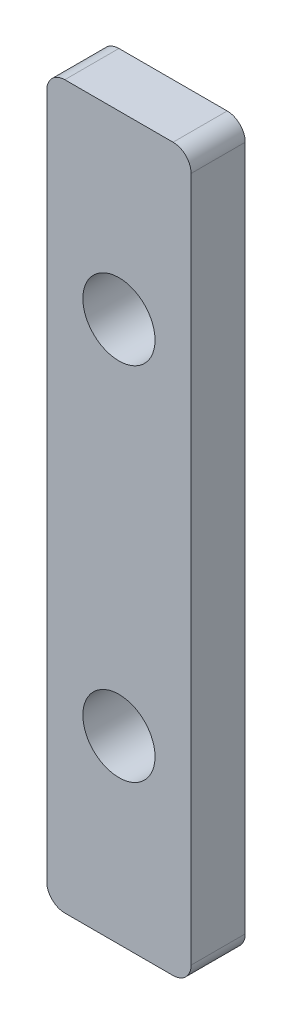
from build123d import *

# Parameters (mm, degrees)
SKETCH1_W           = 8
SKETCH1_H           = 40
SKETCH1_R           = 2
BOSS_EXTRUDE1_DEPTH = 3
FILLET1_R           = 1


with BuildPart() as part:
    # Sketch1 → Boss-Extrude1 (new body)
    with BuildSketch(Plane.XY):
        with Locations((4, 20)):
            Rectangle(SKETCH1_W, SKETCH1_H)
        with Locations((4, 10)):
            Circle(SKETCH1_R, mode=Mode.SUBTRACT)
        with Locations((4, 30)):
            Circle(SKETCH1_R, mode=Mode.SUBTRACT)
    extrude(amount=BOSS_EXTRUDE1_DEPTH)

    # Fillet1
    fillet1_edges = [part.edges().sort_by_distance(p)[0] for p in [
        (0, 40, 1.5),
        (8, 40, 1.5),
        (8, 0, 1.5),
        (0, 0, 1.5),
    ]]
    fillet(fillet1_edges, radius=FILLET1_R)


solid = part.part
